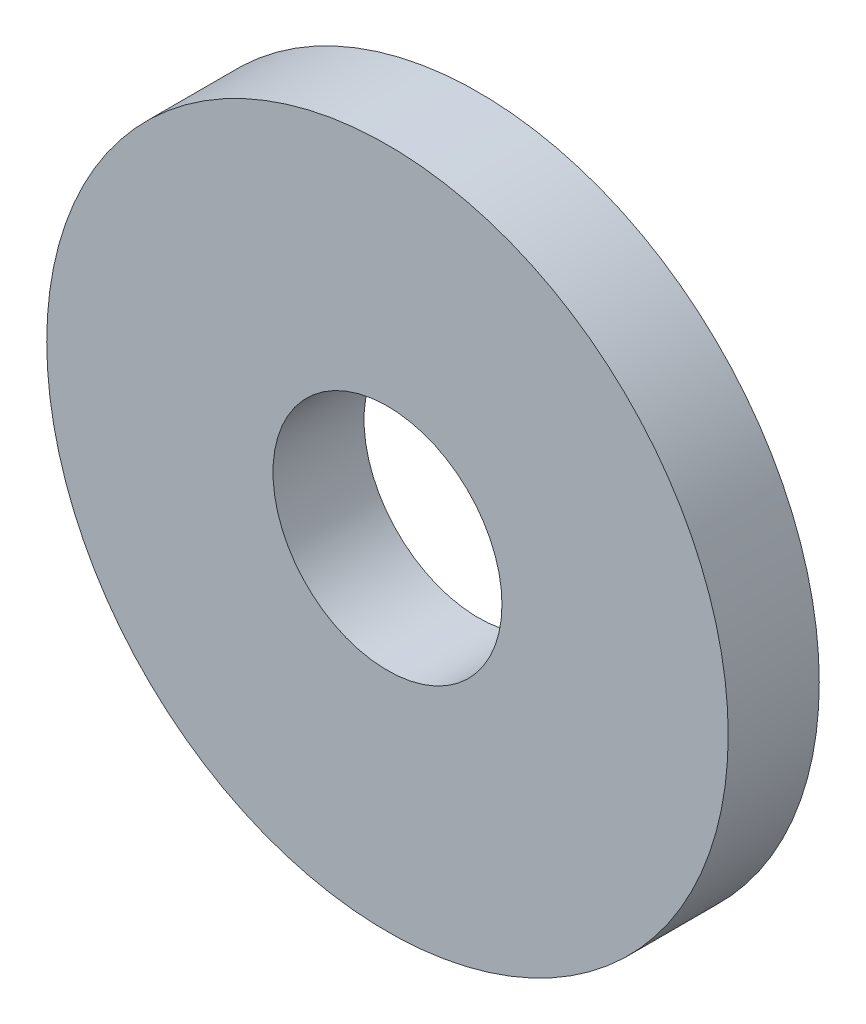
from build123d import *

# Parameters (mm, degrees)
SKETCH_1_R      = 14.97
SKETCH_1_R_2    = 5.03
EXTRUDE_1_DEPTH = 4


with BuildPart() as part:
    # 草图1 → 凸台-拉伸1 (new body)
    with BuildSketch(Plane.XY):
        Circle(SKETCH_1_R)
        Circle(SKETCH_1_R_2, mode=Mode.SUBTRACT)
    extrude(amount=EXTRUDE_1_DEPTH)


solid = part.part
